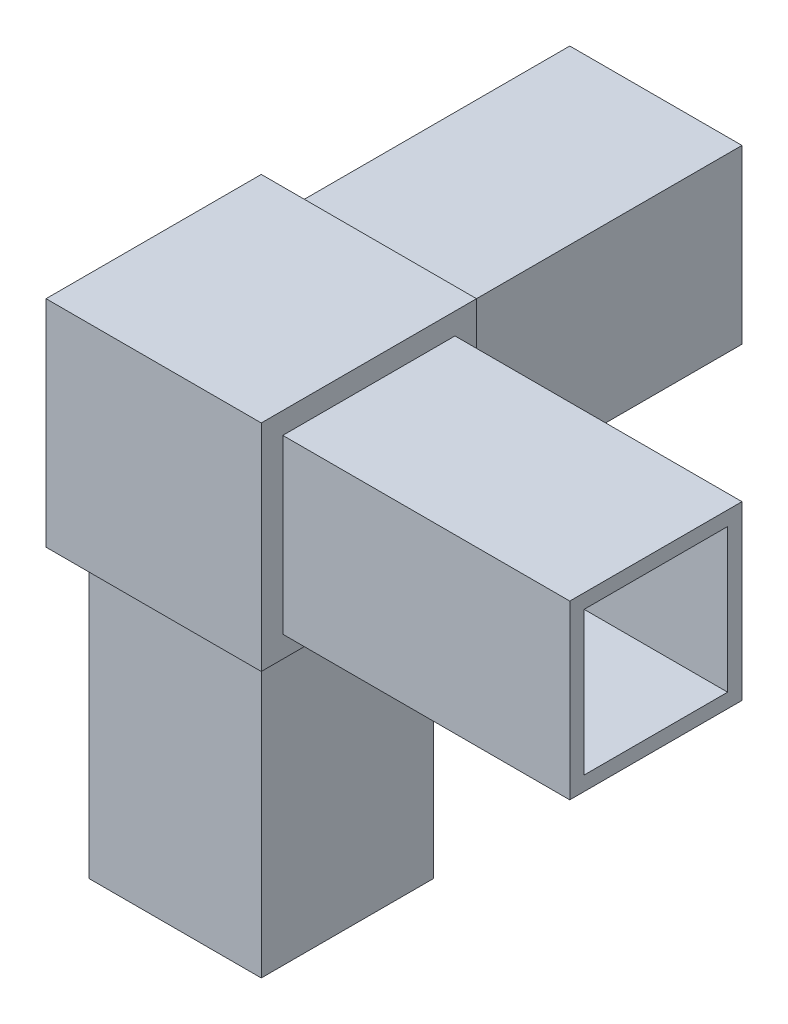
from build123d import *

# Parameters (mm, degrees)
CROQUIS1_W     = 30
CROQUIS1_H     = 40
CROQUIS1_H_2   = 30
CROQUIS1_W_2   = 40
EXTRUIR1_DEPTH = 30
CROQUIS5_W     = 30
CROQUIS5_H     = 30
EXTRUIR4_DEPTH = 40
CROQUIS2_W     = 30
CROQUIS2_H     = 30
CROQUIS2_W_2   = 24
CROQUIS2_H_2   = 24
EXTRUIR2_DEPTH = 40
CROQUIS3_W     = 30
CROQUIS3_H     = 30
CROQUIS3_W_2   = 24
CROQUIS3_H_2   = 24
EXTRUIR3_DEPTH = 40
CROQUIS7_W     = 30
CROQUIS7_H     = 30
CROQUIS7_W_2   = 24
CROQUIS7_H_2   = 24
EXTRUIR5_DEPTH = 40
VACIADO1_T     = -2


with BuildPart() as part:
    # Croquis1 → Extruir1 (new body)
    with BuildSketch(Plane(origin=(0, 0, 0), x_dir=(1, 0, 0), z_dir=(0, 1, 0))):
        with Locations((0, 35)):
            Rectangle(CROQUIS1_W, CROQUIS1_H)
        Rectangle(CROQUIS1_W, CROQUIS1_H_2)
        with Locations((35, 0)):
            Rectangle(CROQUIS1_W_2, CROQUIS1_H_2)
    extrude(amount=EXTRUIR1_DEPTH)

    # Croquis5 → Extruir4 (add)
    with BuildSketch(Plane.XZ):
        Rectangle(CROQUIS5_W, CROQUIS5_H)
    extrude(amount=EXTRUIR4_DEPTH)

    # Croquis2 → Extruir2 (cut)
    with BuildSketch(Plane(origin=(55, 0, 0), x_dir=(0, 0, -1), z_dir=(1, 0, 0))):
        with Locations((0, 15)):
            Rectangle(CROQUIS2_W, CROQUIS2_H)
        with Locations((0, 15)):
            Rectangle(CROQUIS2_W_2, CROQUIS2_H_2, mode=Mode.SUBTRACT)
    extrude(amount=-EXTRUIR2_DEPTH, mode=Mode.SUBTRACT)

    # Croquis3 → Extruir3 (cut)
    with BuildSketch(Plane(origin=(0, 0, -55), x_dir=(-1, 0, 0), z_dir=(0, 0, -1))):
        with Locations((0, 15)):
            Rectangle(CROQUIS3_W, CROQUIS3_H)
        with Locations((0, 15)):
            Rectangle(CROQUIS3_W_2, CROQUIS3_H_2, mode=Mode.SUBTRACT)
    extrude(amount=-EXTRUIR3_DEPTH, mode=Mode.SUBTRACT)

    # Croquis7 → Extruir5 (cut)
    with BuildSketch(Plane.XZ.offset(40)):
        Rectangle(CROQUIS7_W, CROQUIS7_H)
        Rectangle(CROQUIS7_W_2, CROQUIS7_H_2, mode=Mode.SUBTRACT)
    extrude(amount=-EXTRUIR5_DEPTH, mode=Mode.SUBTRACT)

    # Vaciado1
    vaciado1_openings = [part.faces().sort_by_distance(p)[0] for p in [
        (55, 15, 0),
        (0, 15, -55),
        (0, -40, 0),
    ]]
    offset(amount=VACIADO1_T, openings=vaciado1_openings, kind=Kind.INTERSECTION)


solid = part.part
